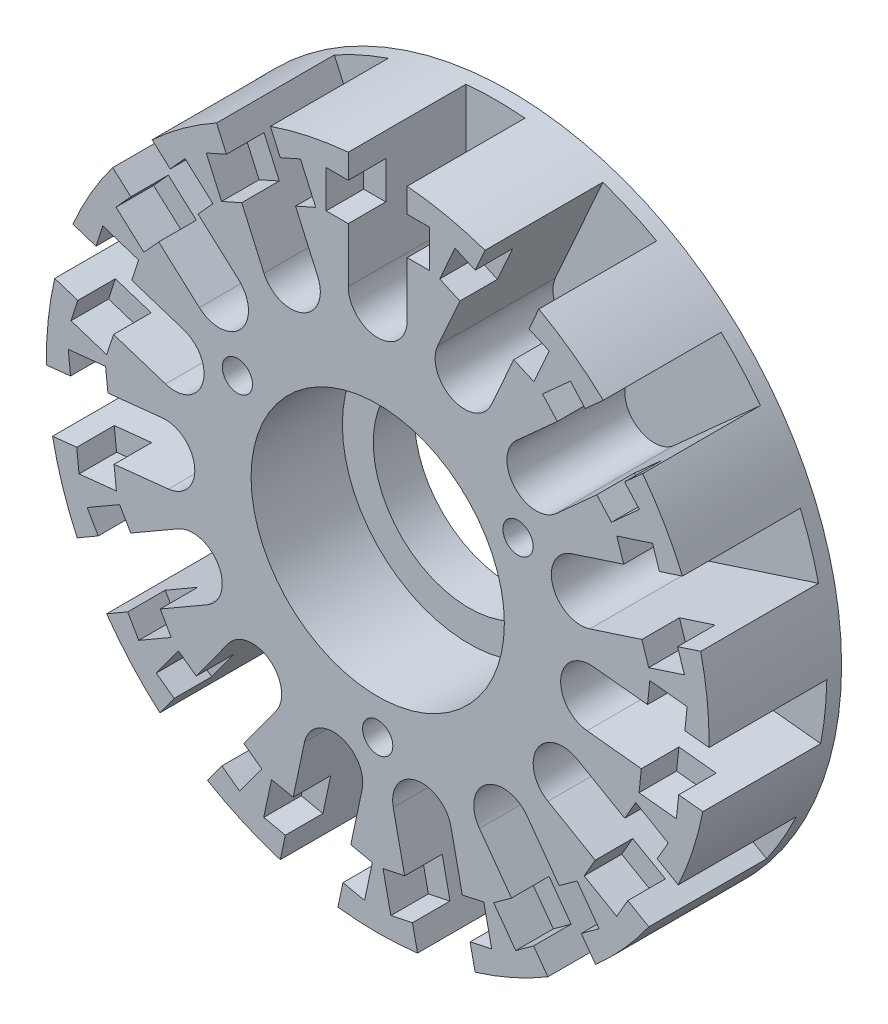
from build123d import *

# Parameters (mm, degrees)
SKETCH1_W                                = 22.5
SKETCH1_H                                = 9
CUT_EXTRUDE1_START                       = -8
CUT_EXTRUDE1_DEPTH                       = 8
SKETCH3_W                                = 2.55
SKETCH3_H                                = 2.55
CUT_EXTRUDE2_DEPTH                       = 1.5
SKETCH4_W                                = 2.55
SKETCH4_H                                = 2.55
CUT_EXTRUDE3_DEPTH                       = 1.5
F_2_05_2_05_DIAMETER_HOLE1_D             = 2.05
F_2_05_2_05_DIAMETER_HOLE1_DEPTH         = 8
F_2_05_2_05_DIAMETER_HOLE1_TIP           = 0.615882135
CBORE_FOR_M12_HEX_HEAD_BOLT1_D           = 13
CBORE_FOR_M12_HEX_HEAD_BOLT1_CBORE_D     = 17.2
CBORE_FOR_M12_HEX_HEAD_BOLT1_CBORE_DEPTH = 6.2
F_2_5_2_5_DIAMETER_HOLE1_D               = 2.5
F_2_5_2_5_DIAMETER_HOLE1_DEPTH           = 5
F_2_5_2_5_DIAMETER_HOLE1_TIP             = 0.751075774
CIRPATTERN1_COUNT                        = 15


with BuildPart() as part:
    # Sketch1 → Revolve1 (revolve)
    with BuildSketch(Plane(origin=(0, 0, 0), x_dir=(1, 0, 0), z_dir=(0, 1, 0))):
        with Locations((11.25, -4.5)):
            Rectangle(SKETCH1_W, SKETCH1_H)
    revolve(axis=Axis((0, 0, 0), (0, 0, 1)))

    # Sketch2 → Cut-Extrude1 (cut)
    with BuildSketch(Plane.XY.offset(9).offset(CUT_EXTRUDE1_START)):
        with BuildLine():
            Line((-1.999999998, 22.410934831), (-1.999999998, 14.5))
            ThreePointArc((-1.999999998, 14.5), (3e-09, 12.499999999), (2.000000005, 14.5))
            Line((2.000000005, 14.5), (2.000000005, 22.410934831))
            ThreePointArc((2.000000005, 22.410934831), (3e-09, 22.5), (-1.999999998, 22.410934831))
        make_face()
    cut_extrude1 = extrude(amount=CUT_EXTRUDE1_DEPTH, mode=Mode.SUBTRACT)

    # Sketch3 → Cut-Extrude2 (cut)
    with BuildSketch(Plane.ZY.offset(-2.000000005)):
        with Locations((7.725, 19.485934831)):
            Rectangle(SKETCH3_W, SKETCH3_H)
    cut_extrude2 = extrude(amount=-CUT_EXTRUDE2_DEPTH, mode=Mode.SUBTRACT)

    # Sketch4 → Cut-Extrude3 (cut)
    with BuildSketch(Plane(origin=(-1.999999998, 0, 0), x_dir=(0, 0, -1), z_dir=(1, 0, 0))):
        with Locations((-7.725, 19.485934831)):
            Rectangle(SKETCH4_W, SKETCH4_H)
    cut_extrude3 = extrude(amount=-CUT_EXTRUDE3_DEPTH, mode=Mode.SUBTRACT)

    # Ø2.05 (2.05) Diameter Hole1
    with Locations(Plane.XY.offset(9)):
        with Locations((9.526279442, 5.5), (0, -11), (-9.526279442, 5.5)):
            Hole(F_2_05_2_05_DIAMETER_HOLE1_D / 2, depth=F_2_05_2_05_DIAMETER_HOLE1_DEPTH)
            with Locations((0, 0, -(F_2_05_2_05_DIAMETER_HOLE1_DEPTH + F_2_05_2_05_DIAMETER_HOLE1_TIP / 2))):  # 118° drill point
                Cone(0, F_2_05_2_05_DIAMETER_HOLE1_D / 2, F_2_05_2_05_DIAMETER_HOLE1_TIP, mode=Mode.SUBTRACT)

    # CBORE for M12 Hex Head Bolt1 (through all)
    with Locations(Plane.XY.offset(9)):
        with Locations((0, 0)):
            CounterBoreHole(CBORE_FOR_M12_HEX_HEAD_BOLT1_D / 2, CBORE_FOR_M12_HEX_HEAD_BOLT1_CBORE_D / 2, CBORE_FOR_M12_HEX_HEAD_BOLT1_CBORE_DEPTH)

    # Ø2.5 (2.5) Diameter Hole1
    with Locations(Plane(origin=(0, 0, 0), x_dir=(-1, 0, 0), z_dir=(0, 0, -1))):
        with Locations((16.887495374, 9.75), (-16.887495374, 9.75), (0, -19.5)):
            Hole(F_2_5_2_5_DIAMETER_HOLE1_D / 2, depth=F_2_5_2_5_DIAMETER_HOLE1_DEPTH)
            with Locations((0, 0, -(F_2_5_2_5_DIAMETER_HOLE1_DEPTH + F_2_5_2_5_DIAMETER_HOLE1_TIP / 2))):  # 118° drill point
                Cone(0, F_2_5_2_5_DIAMETER_HOLE1_D / 2, F_2_5_2_5_DIAMETER_HOLE1_TIP, mode=Mode.SUBTRACT)

    # CirPattern1: Cut-Extrude1, Cut-Extrude2, Cut-Extrude3 ×15 about axis
    cirpattern1_axis = Axis((0, 0, 0), (0, 0, 1))
    add([cut_extrude1.rotate(cirpattern1_axis, i * 360 / CIRPATTERN1_COUNT) for i in range(1, CIRPATTERN1_COUNT)], mode=Mode.SUBTRACT)
    add([cut_extrude2.rotate(cirpattern1_axis, i * 360 / CIRPATTERN1_COUNT) for i in range(1, CIRPATTERN1_COUNT)], mode=Mode.SUBTRACT)
    add([cut_extrude3.rotate(cirpattern1_axis, i * 360 / CIRPATTERN1_COUNT) for i in range(1, CIRPATTERN1_COUNT)], mode=Mode.SUBTRACT)


solid = part.part
